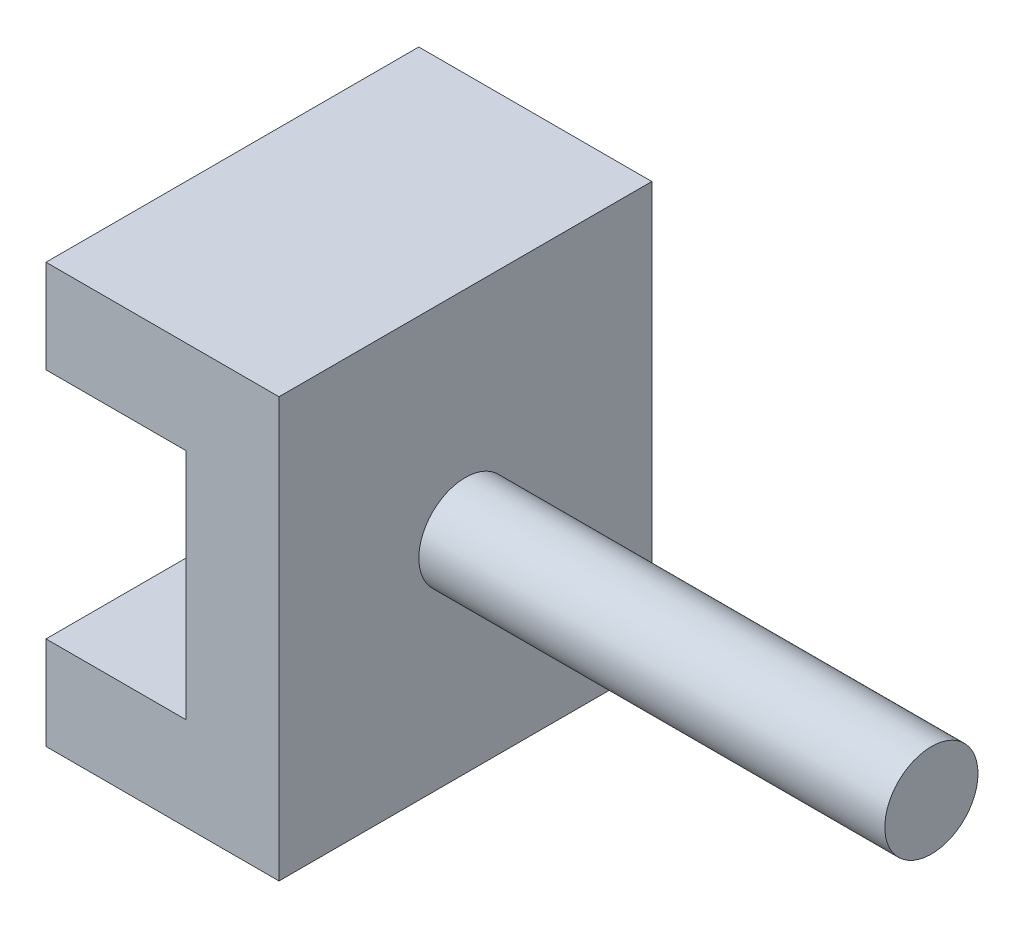
from build123d import *

# Parameters (mm, degrees)
BOSS_EXTRUDE1_DEPTH = 40
SKETCH2_R           = 5
BOSS_EXTRUDE2_DEPTH = 50


with BuildPart() as part:
    # Sketch1 → Boss-Extrude1 (new body)
    with BuildSketch(Plane.XY):
        Polygon((0, 10), (0, 35), (0, 45), (-25, 45), (-25, 35), (-10, 35), (-10, 10), (-25, 10), (-25, 0), (0, 0), align=None)
    extrude(amount=BOSS_EXTRUDE1_DEPTH)

    # Sketch2 → Boss-Extrude2 (add)
    with BuildSketch(Plane(origin=(0, 0, 0), x_dir=(0, 0, -1), z_dir=(1, 0, 0))):
        with Locations((-20, 22.5)):
            Circle(SKETCH2_R)
    extrude(amount=BOSS_EXTRUDE2_DEPTH)


solid = part.part
